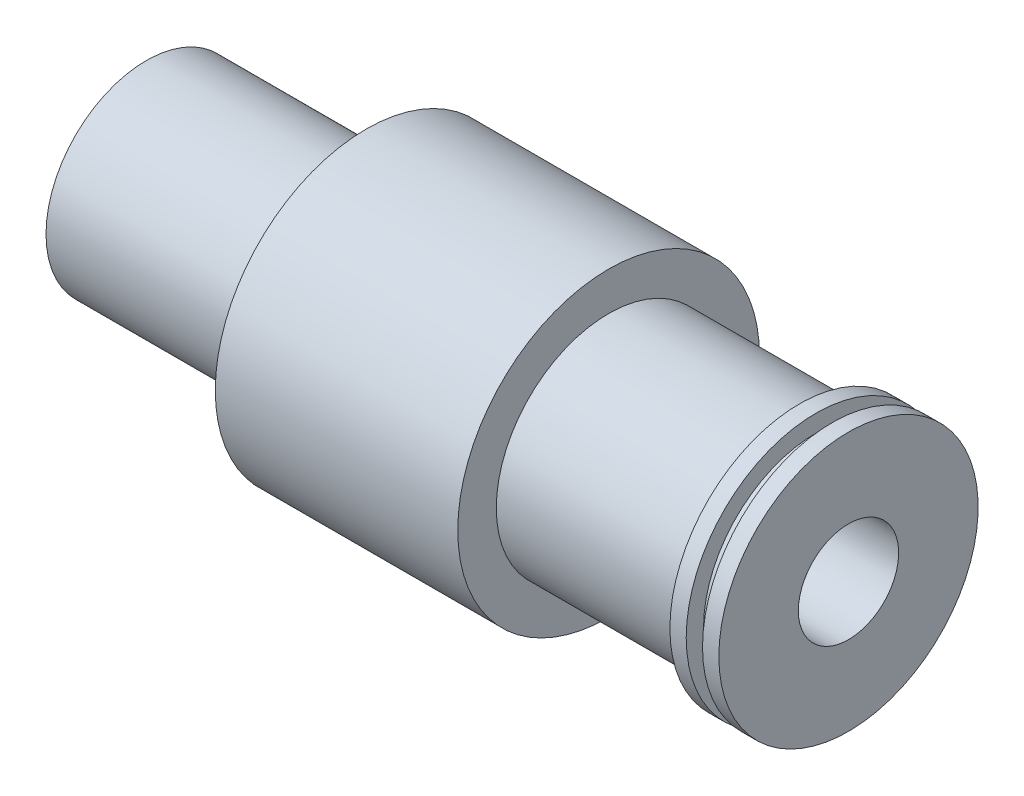
from build123d import *


with BuildPart() as part:
    # Sketch1 → Revolve1 (revolve)
    with BuildSketch(Plane.XY):
        Polygon((-11.1125, 1.5875), (-11.1125, 3.175), (-4.154182796, 3.175), (-4.154182796, 4.7752), (3.520501581, 4.7752), (3.520501581, 3.556), (9.563518218, 3.556), (9.563518218, 4.104105118), (10.079845478, 4.104105118), (10.079845478, 3.556), (10.596172739, 3.556), (10.596172739, 4.104105118), (11.1125, 4.104105118), (11.1125, 1.5875), align=None)
    revolve(axis=Axis((-11.1125, 0, 0), (1, 0, 0)))


solid = part.part
